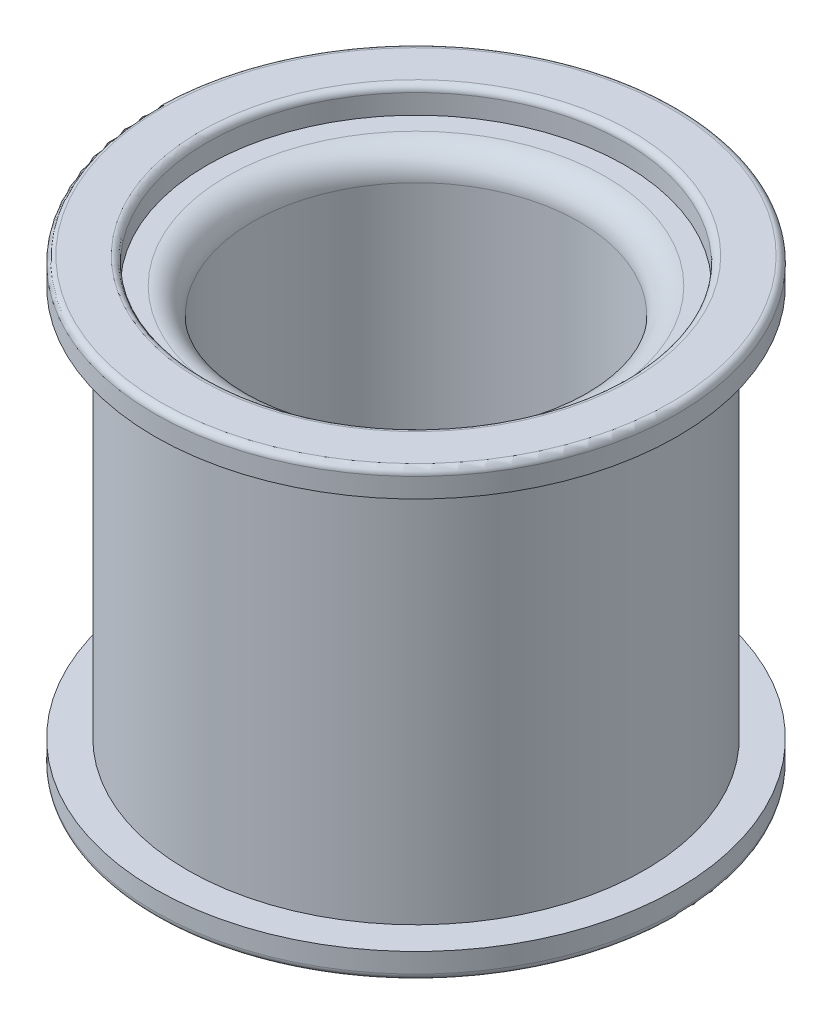
from build123d import *

# Parameters (mm, degrees)
SZKIC1_R                    = 17.5
SZKIC1_R_2                  = 12.5
DODANIE_WYCI_GNI_CIE1_DEPTH = 15
SZKIC2_R                    = 20
SZKIC2_R_2                  = 16
DODANIE_WYCI_GNI_CIE2_DEPTH = 2
ZAOKR_GLENIE1_R             = 0.5
ZAOKR_GLENIE2_R             = 2
ZAOKR_GLENIE2_OF_LUSTRO3_R  = 2
SZKIC3_R                    = 20
SZKIC3_R_2                  = 16
DODANIE_WYCI_GNI_CIE3_DEPTH = 2
ZAOKR_GLENIE3_R             = 0.5


with BuildPart() as part:
    # Szkic1 → Dodanie-wyciągnięcie1 (new body)
    with BuildSketch(Plane(origin=(0, 0, 0), x_dir=(1, 0, 0), z_dir=(0, 1, 0))):
        with Locations(Location((0, 0, 0), (0, 0, 270))):
            Circle(SZKIC1_R)
        with Locations(Location((0, 0, 0), (0, 0, 270))):
            Circle(SZKIC1_R_2, mode=Mode.SUBTRACT)
    dodanie_wyci_gni_cie1 = extrude(amount=DODANIE_WYCI_GNI_CIE1_DEPTH)

    # Zaokrąglenie2
    zaokr_glenie2_edges = [part.edges().sort_by_distance(p)[0] for p in [
        (0, 15, -12.5),
    ]]
    fillet(zaokr_glenie2_edges, radius=ZAOKR_GLENIE2_R)

    # Lustro3: Dodanie-wyciągnięcie1 across plane
    add(dodanie_wyci_gni_cie1.mirror(Plane.ZX))

    # Zaokrąglenie2 of Lustro3
    zaokr_glenie2_of_lustro3_edges = [part.edges().sort_by_distance(p)[0] for p in [
        (0, -15, -12.5),
    ]]
    fillet(zaokr_glenie2_of_lustro3_edges, radius=ZAOKR_GLENIE2_OF_LUSTRO3_R)


with BuildPart() as body_2:
    # Szkic2 → Dodanie-wyciągnięcie2 (new body)
    with BuildSketch(Plane(origin=(0, 15, 0), x_dir=(1, 0, 0), z_dir=(0, 1, 0))):
        with Locations(Location((0, 0, 0), (0, 0, 270))):
            Circle(SZKIC2_R)
        with Locations(Location((0, 0, 0), (0, 0, 270))):
            Circle(SZKIC2_R_2, mode=Mode.SUBTRACT)
    extrude(amount=DODANIE_WYCI_GNI_CIE2_DEPTH)

    # Zaokrąglenie1
    zaokr_glenie1_edges = [body_2.edges().sort_by_distance(p)[0] for p in [
        (0, 17, -20),
        (0, 17, -16),
    ]]
    fillet(zaokr_glenie1_edges, radius=ZAOKR_GLENIE1_R)


with BuildPart() as body_3:
    # Szkic3 → Dodanie-wyciągnięcie3 (new body)
    with BuildSketch(Plane.XZ.offset(15)):
        with Locations(Location((0, 0, 0), (0, 0, 270))):
            Circle(SZKIC3_R)
        with Locations(Location((0, 0, 0), (0, 0, 270))):
            Circle(SZKIC3_R_2, mode=Mode.SUBTRACT)
    extrude(amount=DODANIE_WYCI_GNI_CIE3_DEPTH)

    # Zaokrąglenie3
    zaokr_glenie3_edges = [body_3.edges().sort_by_distance(p)[0] for p in [
        (0, -17, 20),
        (0, -17, 16),
    ]]
    fillet(zaokr_glenie3_edges, radius=ZAOKR_GLENIE3_R)


solid = Compound([part.part, body_2.part, body_3.part])
